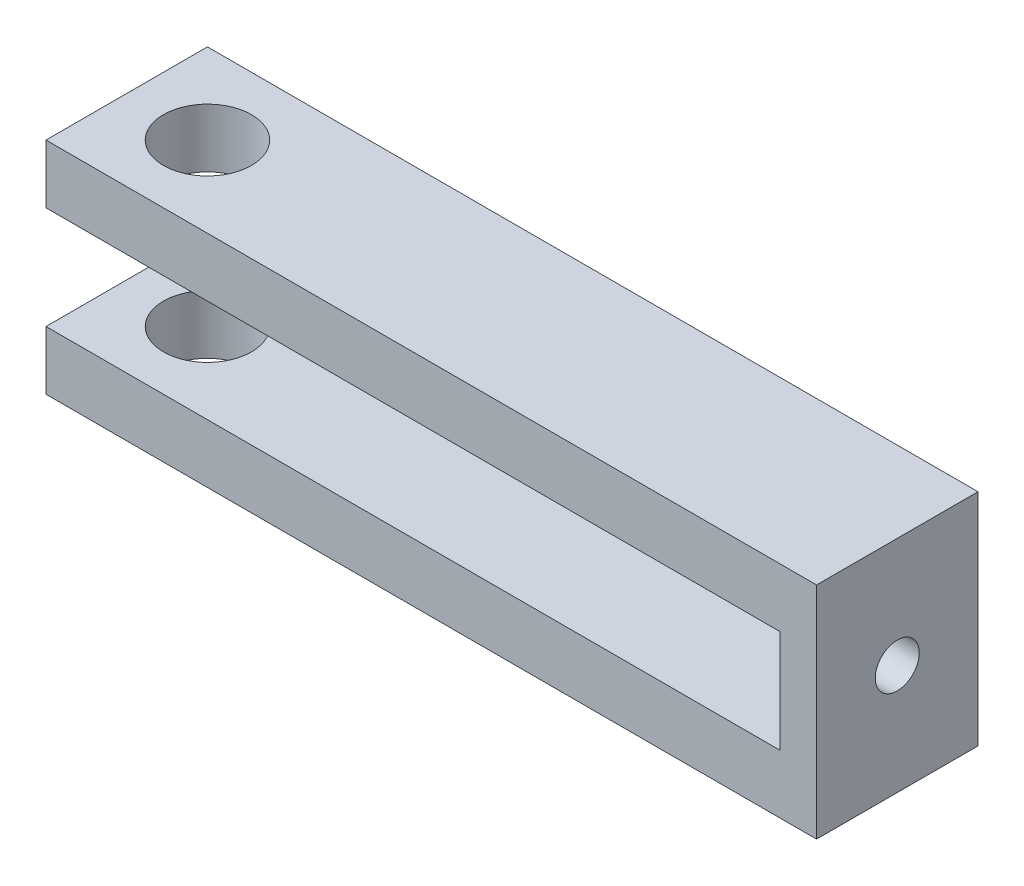
from build123d import *

# Parameters (mm, degrees)
EXTRUDE_1_DEPTH     = 22
SKETCH_2_R          = 6
CUT_EXTRUDE_1_DEPTH = 112.39569112
SKETCH_3_R          = 3
CUT_EXTRUDE_2_DEPTH = 109.323589305


with BuildPart() as part:
    # ｽｹｯﾁ1 → ﾎﾞｽ - 押し出し1 (new body)
    with BuildSketch(Plane.XY):
        Polygon((-105, 15), (-105, 7), (-5, 7), (-5, -7), (-105, -7), (-105, -15), (0, -15), (0, 15), align=None)
    extrude(amount=EXTRUDE_1_DEPTH)

    # ｽｹｯﾁ2 → ｶｯﾄ - 押し出し1 (cut, through all)
    with BuildSketch(Plane.XZ.offset(15)):
        with Locations(Location((-94, 11, 0), (0, 0, 270))):
            Circle(SKETCH_2_R)
    extrude(amount=-CUT_EXTRUDE_1_DEPTH, mode=Mode.SUBTRACT)

    # ｽｹｯﾁ3 → ｶｯﾄ - 押し出し2 (cut, through all)
    with BuildSketch(Plane(origin=(0, 0, 0), x_dir=(0, 0, -1), z_dir=(1, 0, 0))):
        with Locations(Location((-11, 0, 0), (0, 0, 90))):
            Circle(SKETCH_3_R)
    extrude(amount=-CUT_EXTRUDE_2_DEPTH, mode=Mode.SUBTRACT)


solid = part.part
